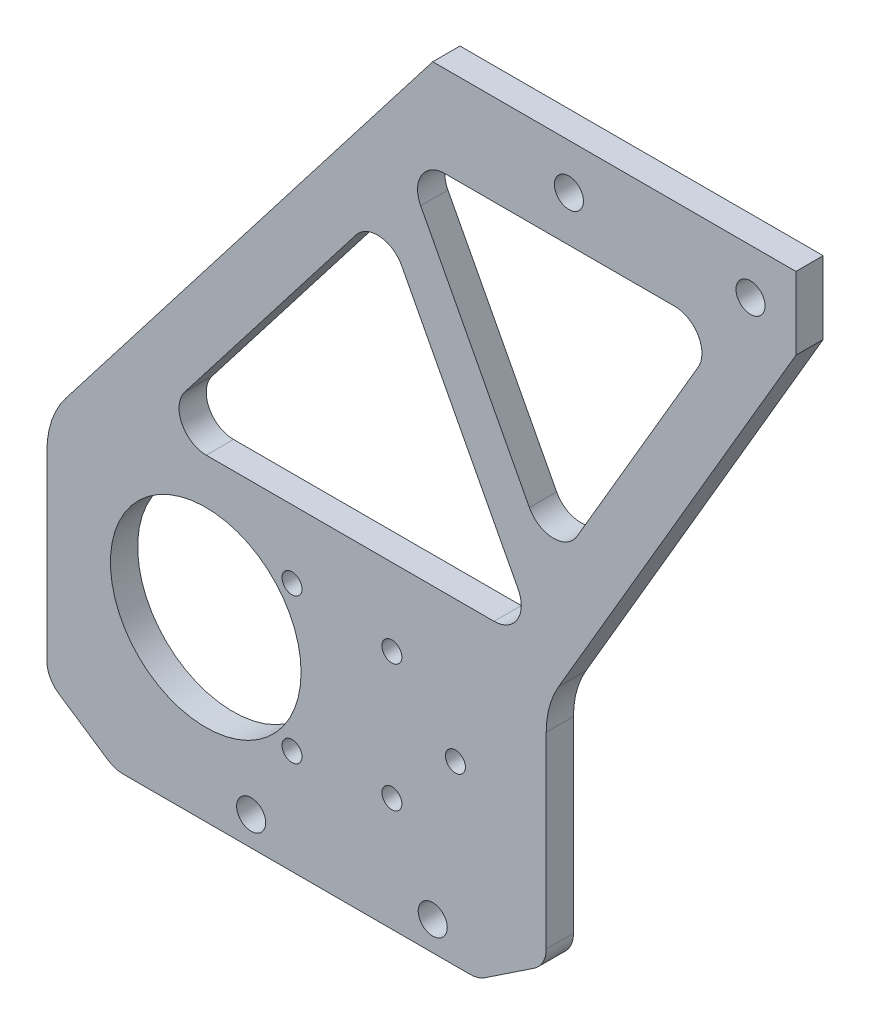
from build123d import *

# Parameters (mm, degrees)
EXTRUDE_3_DEPTH     = 3
SKETCH_6_R          = 1.6
SKETCH_6_R_2        = 1.1
SKETCH_6_R_3        = 10.5
CUT_EXTRUDE_1_DEPTH = 106.547382725
CUT_EXTRUDE_2_DEPTH = 10
FILLET_1_R          = 10
FILLET_2_R          = 3


with BuildPart() as part:
    # 草图5 → 凸台-拉伸3 (new body)
    with BuildSketch(Plane.XY):
        Polygon((-20, 0), (20, 0), (20, -8), (-7.5, -55), (-7.5, -80), (-15, -85), (-55, -85), (-62.5, -80), (-62.5, -55), align=None)
    extrude(amount=EXTRUDE_3_DEPTH)

    # 草图6 → 切除-拉伸1 (cut, through all)
    with BuildSketch(Plane.XY.offset(3)):
        with Locations((-5, -5)):
            Circle(SKETCH_6_R)
        with Locations((15, -5)):
            Circle(SKETCH_6_R)
        with Locations((-40, -81.8)):
            Circle(SKETCH_6_R)
        with Locations((-20, -81.8)):
            Circle(SKETCH_6_R)
        with Locations((-17.5, -65.5)):
            Circle(SKETCH_6_R_2)
        with Locations((-24.5, -58.5)):
            Circle(SKETCH_6_R_2)
        with Locations((-35.5, -57.5)):
            Circle(SKETCH_6_R_2)
        with Locations(Location((-35.5, -73.5, 0), (0, 0, 180))):
            Circle(SKETCH_6_R_2)
        with Locations(Location((-24.5, -72.5, 0), (0, 0, 180))):
            Circle(SKETCH_6_R_2)
        with Locations((-45, -65.5)):
            Circle(SKETCH_6_R_3)
    extrude(amount=-CUT_EXTRUDE_1_DEPTH, mode=Mode.SUBTRACT)

    # 草图7 → 切除-拉伸2 (cut)
    with BuildSketch(Plane.XY.offset(3)):
        with BuildLine():
            Line((-28.443219333, -20.739299448), (-47.318132371, -45.165657497))
            ThreePointArc((-47.318132371, -45.165657497), (-47.637140852, -48.322303386), (-44.944277366, -50))
            Line((-44.944277366, -50), (-13.246531534, -50))
            ThreePointArc((-13.246531534, -50), (-10.67911571, -48.551894323), (-10.590292839, -45.605583994))
            Line((-10.590292839, -45.605583994), (-23.413125634, -21.179225945))
            ThreePointArc((-23.413125634, -21.179225945), (-25.807985355, -19.585050137), (-28.443219333, -20.739299448))
        make_face()
        with BuildLine():
            Line((-4.108825767, -37.323278412), (9.236421762, -14.515037181))
            ThreePointArc((9.236421762, -14.515037181), (9.249498939, -11.507537529), (6.647085488, -10))
            Line((6.647085488, -10), (-18.671550094, -10))
            ThreePointArc((-18.671550094, -10), (-21.238965917, -11.448105677), (-21.327788788, -14.394416006))
            Line((-21.327788788, -14.394416006), (-9.354400735, -37.202657237))
            ThreePointArc((-9.354400735, -37.202657237), (-6.76712834, -38.8074484), (-4.108825767, -37.323278412))
        make_face()
    extrude(amount=-CUT_EXTRUDE_2_DEPTH, mode=Mode.SUBTRACT)

    # 圆角1
    fillet_1_edges = [part.edges().sort_by_distance(p)[0] for p in [
        (-62.5, -55, 1.5),
        (-7.5, -55, 1.5),
    ]]
    fillet(fillet_1_edges, radius=FILLET_1_R)

    # 圆角2
    fillet_2_edges = [part.edges().sort_by_distance(p)[0] for p in [
        (-62.5, -80, 1.5),
        (-7.5, -80, 1.5),
        (-15, -85, 1.5),
        (-55, -85, 1.5),
    ]]
    fillet(fillet_2_edges, radius=FILLET_2_R)


solid = part.part
